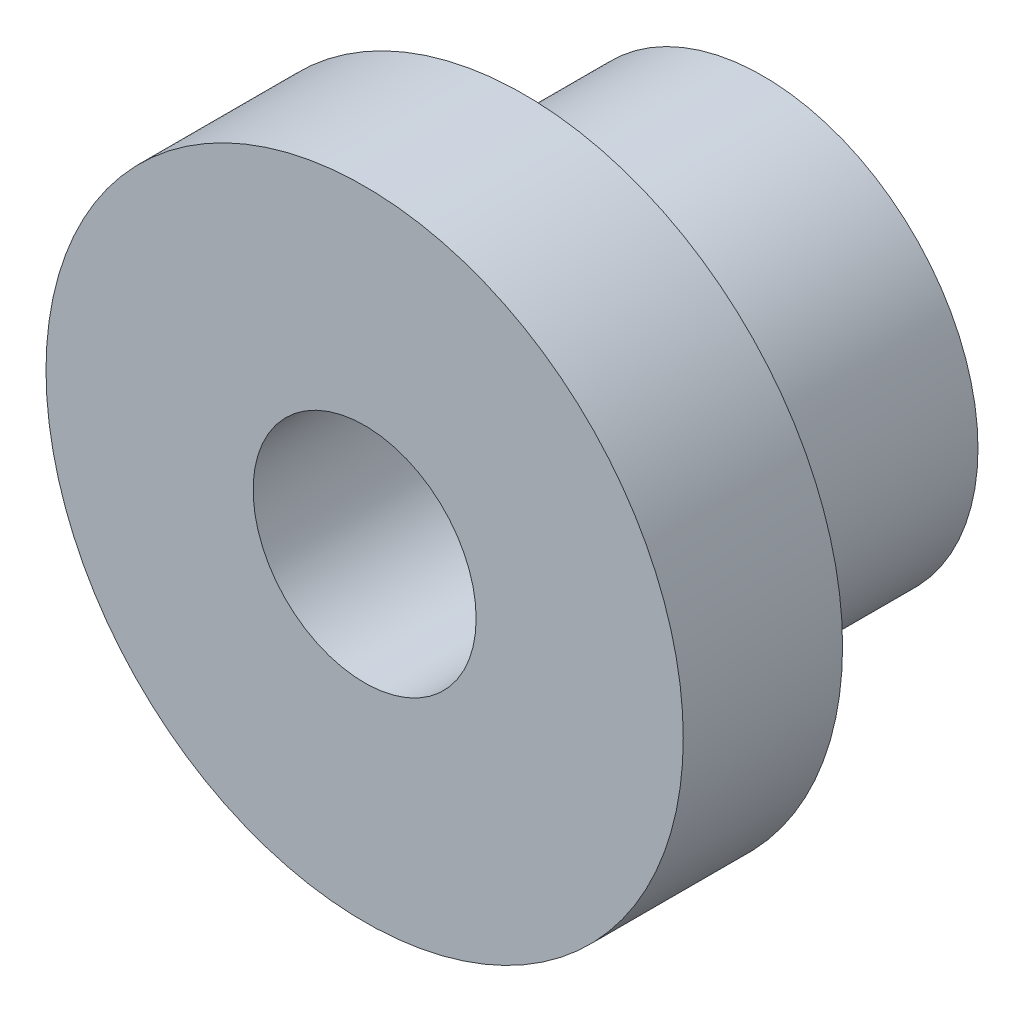
from build123d import *

# Parameters (mm, degrees)
SKETCH1_R           = 2.7
SKETCH1_R_2         = 1.65
BOSS_EXTRUDE1_DEPTH = 3
SKETCH2_R           = 4
SKETCH2_R_2         = 1.4
BOSS_EXTRUDE2_DEPTH = 2


with BuildPart() as part:
    # Sketch1 → Boss-Extrude1 (new body)
    with BuildSketch(Plane.XY):
        Circle(SKETCH1_R)
        Circle(SKETCH1_R_2, mode=Mode.SUBTRACT)
    extrude(amount=BOSS_EXTRUDE1_DEPTH)

    # Sketch2 → Boss-Extrude2 (add)
    with BuildSketch(Plane.XY.offset(3)):
        Circle(SKETCH2_R)
        Circle(SKETCH2_R_2, mode=Mode.SUBTRACT)
    extrude(amount=BOSS_EXTRUDE2_DEPTH)


solid = part.part
